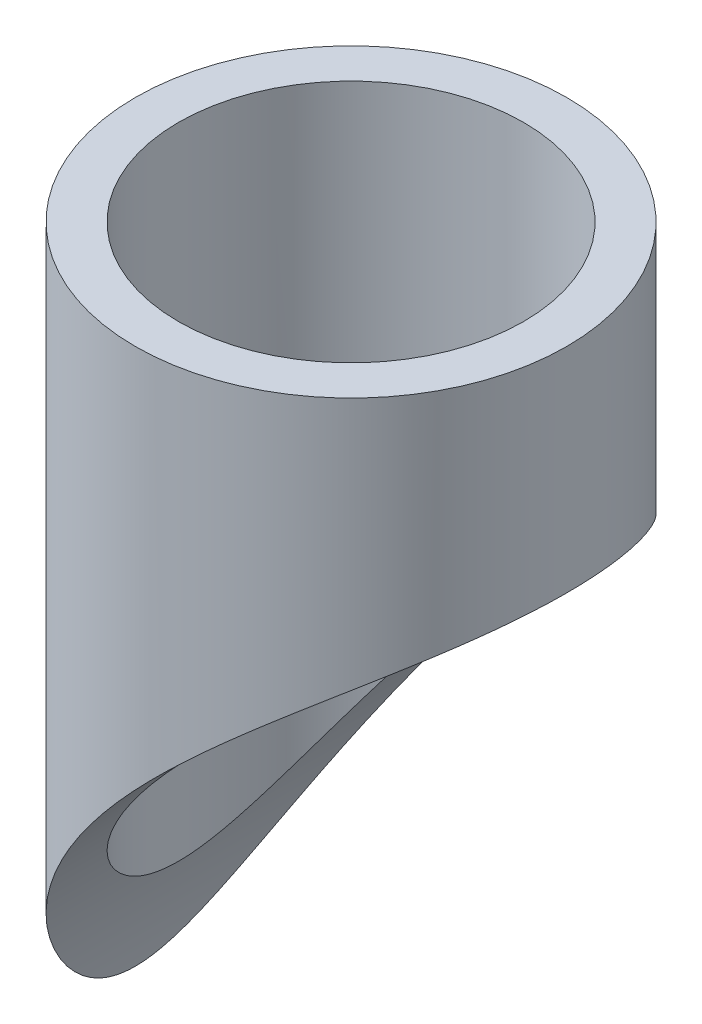
from build123d import *

# Parameters (mm, degrees)
SKETCH1_R               = 15.875
SKETCH1_R_2             = 12.7
BOSS_EXTRUDE1_DEPTH     = 76.2
CUT_EXTRUDE1_DEPTH      = 80.43847462
CUT_EXTRUDE1_DEPTH_BACK = 80.43847462
SKETCH2_R               = 69.85
SKETCH2_R_2             = 63.5


with BuildPart() as part:
    # Sketch1 → Boss-Extrude1 (new body)
    with BuildSketch(Plane(origin=(0, 0, 0), x_dir=(1, 0, 0), z_dir=(0, 1, 0))):
        with Locations(Location((0, 0, 0), (0, 0, 90))):
            Circle(SKETCH1_R)
        with Locations(Location((0, 0, 0), (0, 0, 90))):
            Circle(SKETCH1_R_2, mode=Mode.SUBTRACT)
    extrude(amount=BOSS_EXTRUDE1_DEPTH)

    # Sketch2 → Cut-Extrude1 (cut, two sides: drawn at the far end of the back side and taken through both)
    # profile 1 of 2: a face of its own
    with BuildSketch(Plane.XY.offset(-CUT_EXTRUDE1_DEPTH_BACK)):
        with Locations((50.8, 0)):
            Circle(SKETCH2_R)
        with Locations((50.8, 0)):
            Circle(SKETCH2_R_2, mode=Mode.SUBTRACT)
    # profile 2 of 2: a face of its own
    with BuildSketch(Plane.XY.offset(-CUT_EXTRUDE1_DEPTH_BACK)):
        with Locations((50.8, 0)):
            Circle(SKETCH2_R_2)
    extrude(amount=CUT_EXTRUDE1_DEPTH + CUT_EXTRUDE1_DEPTH_BACK, mode=Mode.SUBTRACT)


solid = part.part
